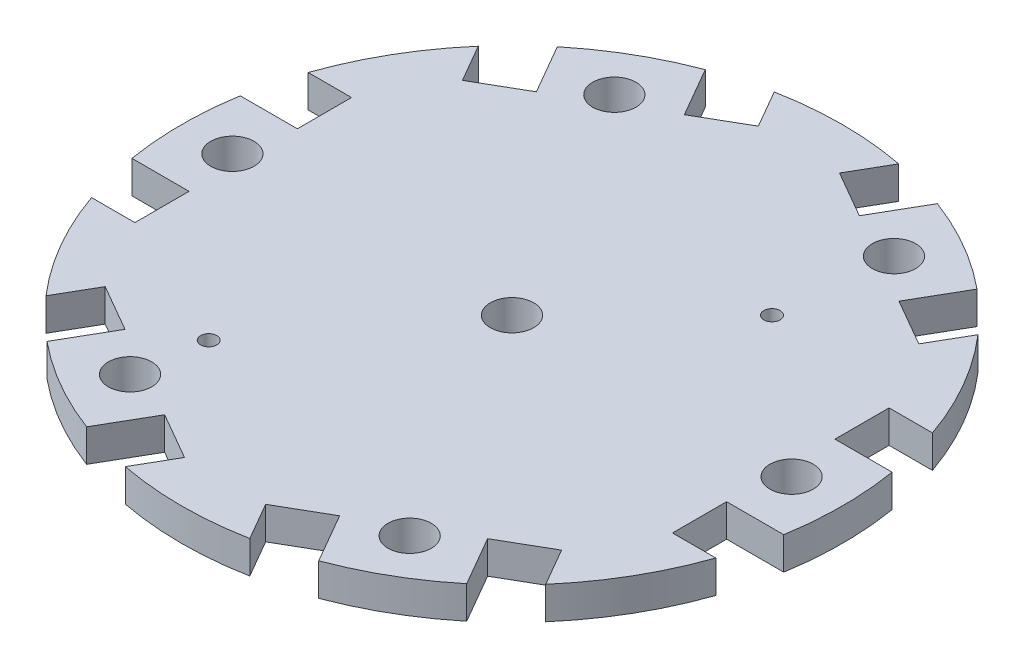
from build123d import *

# Parameters (mm, degrees)
CROQUIS1_R              = 30.5
SALIENTE_EXTRUIR1_DEPTH = 3
CROQUIS2_R              = 2
CORTAR_EXTRUIR1_DEPTH   = 4
CORTAR_EXTRUIR3_START   = -4
CORTAR_EXTRUIR3_DEPTH   = 4
CORTAR_EXTRUIR4_DEPTH   = 10
CROQUIS8_R              = 0.75
CORTAR_EXTRUIR5_DEPTH   = 3


with BuildPart() as part:
    # Croquis1 → Saliente-Extruir1 (new body)
    with BuildSketch(Plane(origin=(0, 0, 0), x_dir=(1, 0, 0), z_dir=(0, 1, 0))):
        with Locations(Location((0, 0, 0), (0, 0, 270))):
            Circle(CROQUIS1_R)
    extrude(amount=SALIENTE_EXTRUIR1_DEPTH)

    # Croquis2 → Cortar-Extruir1 (cut)
    with BuildSketch(Plane(origin=(0, 3, 0), x_dir=(1, 0, 0), z_dir=(0, 1, 0))):
        with Locations(Location((0, 0, 0), (0, 0, 270))):
            Circle(CROQUIS2_R)
    extrude(amount=-CORTAR_EXTRUIR1_DEPTH, mode=Mode.SUBTRACT)

    # Croquis5 → Cortar-Extruir3 (cut)
    with BuildSketch(Plane(origin=(0, 3, 0), x_dir=(1, 0, 0), z_dir=(0, 1, 0)).offset(CORTAR_EXTRUIR3_START)):
        with BuildLine():
            ThreePointArc((-28.814059068, 10), (-29.556634924, 7.526973624), (-30.087372767, 5))
            Line((-30.087372767, 5), (-28.814059068, 5))
            Line((-28.814059068, 5), (-24.814059068, 5))
            Line((-24.814059068, 5), (-24.814059068, 10))
            Line((-24.814059068, 10), (-28.814059068, 10))
        make_face()
        with BuildLine():
            Line((28.814059068, 5), (30.087372767, 5))
            ThreePointArc((30.087372767, 5), (29.556634924, 7.526973624), (28.814059068, 10))
            Line((28.814059068, 10), (24.814059068, 10))
            Line((24.814059068, 10), (24.814059068, 5))
            Line((24.814059068, 5), (28.814059068, 5))
        make_face()
        with BuildLine():
            Line((30.087372767, -5), (28.814059068, -5))
            Line((28.814059068, -5), (24.814059068, -5))
            Line((24.814059068, -5), (24.814059068, -10))
            Line((24.814059068, -10), (28.814059068, -10))
            ThreePointArc((28.814059068, -10), (29.556634924, -7.526973624), (30.087372767, -5))
        make_face()
        with BuildLine():
            ThreePointArc((19.373813402, -23.556429149), (21.296867835, -21.833309883), (23.067283572, -19.953707139))
            Line((23.067283572, -19.953707139), (21.067283572, -16.489605524))
            Line((21.067283572, -16.489605524), (16.737156553, -18.989605524))
            Line((16.737156553, -18.989605524), (18.737156553, -22.453707139))
            Line((18.737156553, -22.453707139), (19.373813402, -23.556429149))
        make_face()
        with BuildLine():
            ThreePointArc((5.746775496, -29.953707139), (8.25976709, -29.360283507), (10.713559364, -28.556429149))
            Line((10.713559364, -28.556429149), (10.076902515, -27.453707139))
            Line((10.076902515, -27.453707139), (8.076902515, -23.989605524))
            Line((8.076902515, -23.989605524), (3.746775496, -26.489605524))
            Line((3.746775496, -26.489605524), (5.746775496, -29.953707139))
        make_face()
        with BuildLine():
            ThreePointArc((-10.713559364, -28.556429149), (-8.25976709, -29.360283507), (-5.746775496, -29.953707139))
            Line((-5.746775496, -29.953707139), (-3.746775496, -26.489605524))
            Line((-3.746775496, -26.489605524), (-8.076902515, -23.989605524))
            Line((-8.076902515, -23.989605524), (-10.076902515, -27.453707139))
            Line((-10.076902515, -27.453707139), (-10.713559364, -28.556429149))
        make_face()
        with BuildLine():
            ThreePointArc((-23.067283572, -19.953707139), (-21.296867835, -21.833309883), (-19.373813402, -23.556429149))
            Line((-19.373813402, -23.556429149), (-18.737156553, -22.453707139))
            Line((-18.737156553, -22.453707139), (-16.737156553, -18.989605524))
            Line((-16.737156553, -18.989605524), (-21.067283572, -16.489605524))
            Line((-21.067283572, -16.489605524), (-23.067283572, -19.953707139))
        make_face()
        with BuildLine():
            ThreePointArc((-30.087372767, -5), (-29.556634924, -7.526973624), (-28.814059068, -10))
            Line((-28.814059068, -10), (-24.814059068, -10))
            Line((-24.814059068, -10), (-24.814059068, -5))
            Line((-24.814059068, -5), (-28.814059068, -5))
            Line((-28.814059068, -5), (-30.087372767, -5))
        make_face()
        with BuildLine():
            Line((-18.737156553, 22.453707139), (-19.373813402, 23.556429149))
            ThreePointArc((-19.373813402, 23.556429149), (-21.296867835, 21.833309883), (-23.067283572, 19.953707139))
            Line((-23.067283572, 19.953707139), (-21.067283572, 16.489605524))
            Line((-21.067283572, 16.489605524), (-16.737156553, 18.989605524))
            Line((-16.737156553, 18.989605524), (-18.737156553, 22.453707139))
        make_face()
        with BuildLine():
            Line((-3.746775496, 26.489605524), (-5.746775496, 29.953707139))
            ThreePointArc((-5.746775496, 29.953707139), (-8.25976709, 29.360283507), (-10.713559364, 28.556429149))
            Line((-10.713559364, 28.556429149), (-10.076902515, 27.453707139))
            Line((-10.076902515, 27.453707139), (-8.076902515, 23.989605524))
            Line((-8.076902515, 23.989605524), (-3.746775496, 26.489605524))
        make_face()
        with BuildLine():
            Line((10.076902515, 27.453707139), (10.713559364, 28.556429149))
            ThreePointArc((10.713559364, 28.556429149), (8.25976709, 29.360283507), (5.746775496, 29.953707139))
            Line((5.746775496, 29.953707139), (3.746775496, 26.489605524))
            Line((3.746775496, 26.489605524), (8.076902515, 23.989605524))
            Line((8.076902515, 23.989605524), (10.076902515, 27.453707139))
        make_face()
        with BuildLine():
            Line((21.067283572, 16.489605524), (23.067283572, 19.953707139))
            ThreePointArc((23.067283572, 19.953707139), (21.296867835, 21.833309883), (19.373813402, 23.556429149))
            Line((19.373813402, 23.556429149), (18.737156553, 22.453707139))
            Line((18.737156553, 22.453707139), (16.737156553, 18.989605524))
            Line((16.737156553, 18.989605524), (21.067283572, 16.489605524))
        make_face()
    extrude(amount=CORTAR_EXTRUIR3_DEPTH, mode=Mode.SUBTRACT)

    # Croquis7 → Cortar-Extruir4 (cut)
    with BuildSketch(Plane(origin=(0, 3, 0), x_dir=(1, 0, 0), z_dir=(0, 1, 0))):
        with BuildLine():
            ThreePointArc((-13.907029535, 20.623580122), (-11.907029535, 20.623580122), (-10.907029535, 22.355630929))
            Line((-10.907029535, 22.355630929), (-12.907029535, 22.355630929))
            Line((-12.907029535, 22.355630929), (-13.907029535, 20.623580122))
        make_face()
        with BuildLine():
            Line((-12.907029535, 22.355630929), (-10.907029535, 22.355630929))
            ThreePointArc((-10.907029535, 22.355630929), (-13.907029535, 24.087681737), (-13.907029535, 20.623580122))
            Line((-13.907029535, 20.623580122), (-12.907029535, 22.355630929))
        make_face()
        with BuildLine():
            ThreePointArc((-23.81405907, 0), (-24.082008262, 1), (-24.81405907, 1.732050808))
            Line((-24.81405907, 1.732050808), (-25.81405907, 0))
            Line((-25.81405907, 0), (-24.81405907, -1.732050808))
            ThreePointArc((-24.81405907, -1.732050808), (-24.082008262, -1), (-23.81405907, 0))
        make_face()
        with BuildLine():
            Line((-25.81405907, 0), (-24.81405907, 1.732050808))
            ThreePointArc((-24.81405907, 1.732050808), (-27.81405907, 0), (-24.81405907, -1.732050808))
            Line((-24.81405907, -1.732050808), (-25.81405907, 0))
        make_face()
        with BuildLine():
            ThreePointArc((10.907029535, 22.355630929), (11.907029535, 20.623580122), (13.907029535, 20.623580122))
            Line((13.907029535, 20.623580122), (12.907029535, 22.355630929))
            Line((12.907029535, 22.355630929), (10.907029535, 22.355630929))
        make_face()
        with BuildLine():
            Line((12.907029535, 22.355630929), (13.907029535, 20.623580122))
            ThreePointArc((13.907029535, 20.623580122), (14.639080343, 21.355630929), (14.907029535, 22.355630929))
            ThreePointArc((14.907029535, 22.355630929), (12.907029535, 24.355630929), (10.907029535, 22.355630929))
            Line((10.907029535, 22.355630929), (12.907029535, 22.355630929))
        make_face()
        with BuildLine():
            Line((24.81405907, -1.732050808), (25.81405907, 0))
            Line((25.81405907, 0), (24.81405907, 1.732050808))
            ThreePointArc((24.81405907, 1.732050808), (23.81405907, 0), (24.81405907, -1.732050808))
        make_face()
        with BuildLine():
            Line((24.81405907, 1.732050808), (25.81405907, 0))
            Line((25.81405907, 0), (24.81405907, -1.732050808))
            ThreePointArc((24.81405907, -1.732050808), (26.81405907, -1.732050808), (27.81405907, 0))
            ThreePointArc((27.81405907, 0), (26.81405907, 1.732050808), (24.81405907, 1.732050808))
        make_face()
        with BuildLine():
            ThreePointArc((-13.907029535, -20.623580122), (-13.907029535, -24.087681737), (-10.907029535, -22.355630929))
            Line((-10.907029535, -22.355630929), (-12.907029535, -22.355630929))
            Line((-12.907029535, -22.355630929), (-13.907029535, -20.623580122))
        make_face()
        with BuildLine():
            Line((-12.907029535, -22.355630929), (-10.907029535, -22.355630929))
            ThreePointArc((-10.907029535, -22.355630929), (-11.907029535, -20.623580122), (-13.907029535, -20.623580122))
            Line((-13.907029535, -20.623580122), (-12.907029535, -22.355630929))
        make_face()
        with BuildLine():
            ThreePointArc((14.907029535, -22.355630929), (14.639080343, -21.355630929), (13.907029535, -20.623580122))
            Line((13.907029535, -20.623580122), (12.907029535, -22.355630929))
            Line((12.907029535, -22.355630929), (10.907029535, -22.355630929))
            ThreePointArc((10.907029535, -22.355630929), (12.907029535, -24.355630929), (14.907029535, -22.355630929))
        make_face()
        with BuildLine():
            Line((12.907029535, -22.355630929), (13.907029535, -20.623580122))
            ThreePointArc((13.907029535, -20.623580122), (11.907029535, -20.623580122), (10.907029535, -22.355630929))
            Line((10.907029535, -22.355630929), (12.907029535, -22.355630929))
        make_face()
    extrude(amount=-CORTAR_EXTRUIR4_DEPTH, mode=Mode.SUBTRACT)

    # Croquis8 → Cortar-Extruir5 (cut)
    with BuildSketch(Plane(origin=(0, 3, 0), x_dir=(1, 0, 0), z_dir=(0, 1, 0))):
        with Locations(Location((12, 12, 0), (0, 0, 270))):
            Circle(CROQUIS8_R)
        with Locations(Location((-12, -16, 0), (0, 0, 270))):
            Circle(CROQUIS8_R)
    extrude(amount=-CORTAR_EXTRUIR5_DEPTH, mode=Mode.SUBTRACT)


solid = part.part
